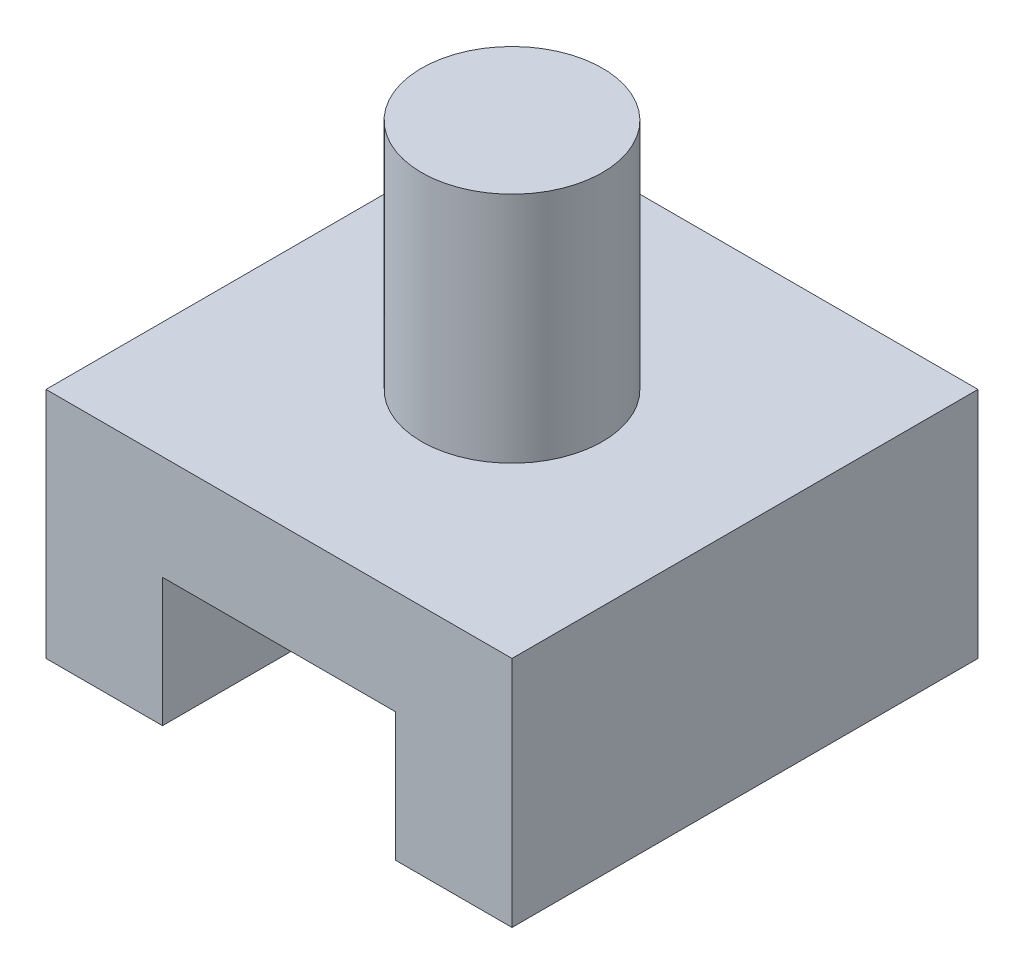
from build123d import *

# Parameters (mm, degrees)
SKETCH1_W           = 40
SKETCH1_H           = 40
BOSS_EXTRUDE1_DEPTH = 20
SKETCH2_W           = 20
SKETCH2_H           = 11.035436779
CUT_EXTRUDE1_DEPTH  = 61
SKETCH3_R           = 7.76528749
BOSS_EXTRUDE2_DEPTH = 20


with BuildPart() as part:
    # Sketch1 → Boss-Extrude1 (new body)
    with BuildSketch(Plane(origin=(0, 0, 0), x_dir=(1, 0, 0), z_dir=(0, 1, 0))):
        with Locations((-20, 20)):
            Rectangle(SKETCH1_W, SKETCH1_H)
    extrude(amount=BOSS_EXTRUDE1_DEPTH)

    # Sketch2 → Cut-Extrude1 (cut, through all)
    with BuildSketch(Plane.XY):
        with Locations((-20, 5.51771839)):
            Rectangle(SKETCH2_W, SKETCH2_H)
    extrude(amount=-CUT_EXTRUDE1_DEPTH, mode=Mode.SUBTRACT)

    # Sketch3 → Boss-Extrude2 (add)
    with BuildSketch(Plane(origin=(0, 20, 0), x_dir=(1, 0, 0), z_dir=(0, 1, 0))):
        with Locations(Location((-20, 20, 0), (0, 0, 270))):
            Circle(SKETCH3_R)
    extrude(amount=BOSS_EXTRUDE2_DEPTH)


solid = part.part
